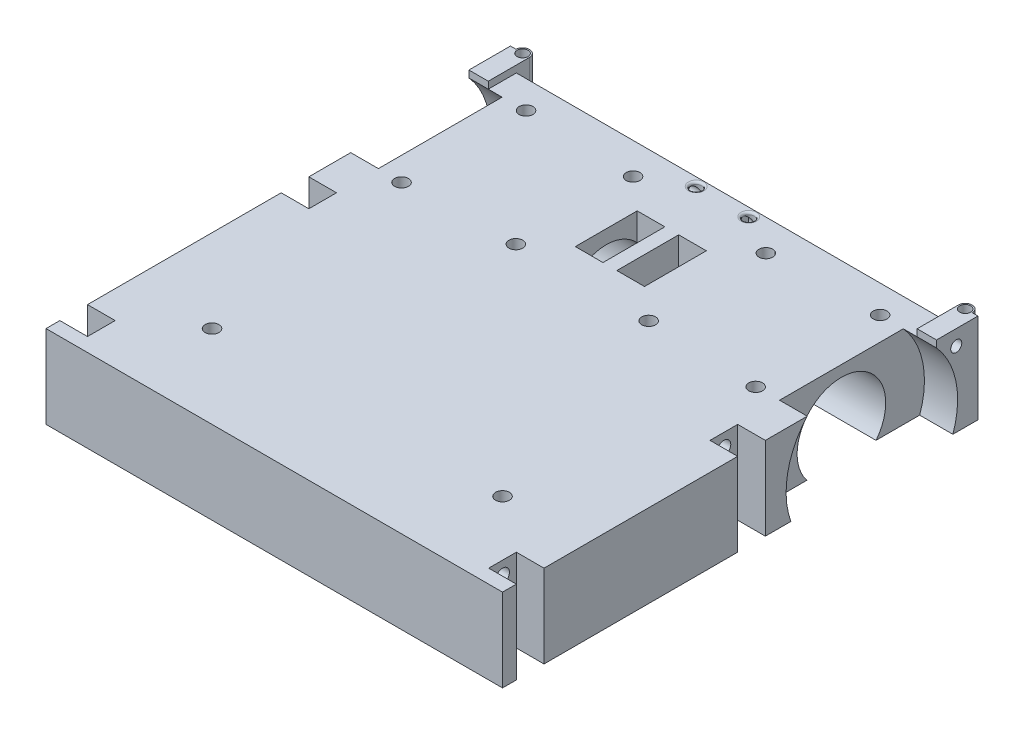
from build123d import *

# Parameters (mm, degrees)
ESQUISSE2_W             = 165
ESQUISSE2_H             = 165
BASE_DEPTH              = 30
ESQUISSE3_R             = 15
BLOC_MOTEUR_1_DEPTH     = 80
ESQUISSE4_W             = 10
ESQUISSE4_H             = 22.360679774
ACCES_MOTEUR_DEPTH      = 37
ESQUISSE6_R             = 16.01
BLOC_MOTEUR_2_DEPTH     = 37
ESQUISSE7_R             = 2.5
VIS_MOTEUR_DEPTH        = 121.467838032
ESQUISSE8_R             = 2.5
VIS_PATIN_DEPTH         = 121.467838032
ESQUISSE12_R            = 30
ESPACE_ROUE_DEPTH       = 10
FIXE_PORTE_1_DEPTH      = 2.5
FIXE_PORTE_1_DEPTH_BACK = 10
ESQUISSE14_R            = 2
ESQUISSE15_W            = 5
ESQUISSE15_H            = 10.139320225
FIXE_PORTE_2_DEPTH      = 2.5
ESQUISSE16_R            = 2
FIXE_PORTE_3_DEPTH      = 10
ESQUISSE18_R            = 2
VIDE_CORDE_COTE_DEPTH   = 75
ESQUISSE19_R            = 2
VIDEO_CORDE_HAUT_DEPTH  = 5
CONGE_CORDE_R           = 0.8
ESQUISSE20_R            = 2
BOSS_MAX_PORTE_DEPTH    = 2
ESQUISSE23_W            = 10
ESQUISSE23_H            = 30
VIDE_TIGE_DEPTH         = 10
VIDE_VIS_REACH          = 185.737
ESQUISSE25_R            = 2.5


with BuildPart() as part:
    # Esquisse2 → BASE (new body)
    with BuildSketch(Plane(origin=(0, 0, 0), x_dir=(1, 0, 0), z_dir=(0, 1, 0))):
        Rectangle(ESQUISSE2_W, ESQUISSE2_H)
    extrude(amount=BASE_DEPTH)

    # Esquisse3 → BLOC MOTEUR 1. (cut)
    with BuildSketch(Plane(origin=(82.5, 0, 0), x_dir=(0, 0, -1), z_dir=(1, 0, 0))):
        with Locations((50, 10)):
            Circle(ESQUISSE3_R)
    bloc_moteur_1 = extrude(amount=-BLOC_MOTEUR_1_DEPTH, mode=Mode.SUBTRACT)

    # Esquisse4 → ACCES MOTEUR (cut)
    with BuildSketch(Plane.XZ):
        with Locations((7.5, -50)):
            Rectangle(ESQUISSE4_W, ESQUISSE4_H)
    acces_moteur = extrude(amount=-ACCES_MOTEUR_DEPTH, mode=Mode.SUBTRACT)

    # Esquisse6 → BLOC MOTEUR 2 (cut)
    with BuildSketch(Plane(origin=(82.5, 0, 0), x_dir=(0, 0, -1), z_dir=(1, 0, 0))):
        with Locations((50, 10)):
            Circle(ESQUISSE6_R)
    bloc_moteur_2 = extrude(amount=-BLOC_MOTEUR_2_DEPTH, mode=Mode.SUBTRACT)

    # SYM BLOC MOTEUR: BLOC MOTEUR 1., ACCES MOTEUR, BLOC MOTEUR 2 across plane
    add(bloc_moteur_1.mirror(Plane(origin=(0, 0, 0), x_dir=(0, 0, 1), z_dir=(1, 0, 0))), mode=Mode.SUBTRACT)
    add(acces_moteur.mirror(Plane(origin=(0, 0, 0), x_dir=(0, 0, 1), z_dir=(1, 0, 0))), mode=Mode.SUBTRACT)
    add(bloc_moteur_2.mirror(Plane(origin=(0, 0, 0), x_dir=(0, 0, 1), z_dir=(1, 0, 0))), mode=Mode.SUBTRACT)

    # Esquisse7 → VIS MOTEUR (cut, through all)
    with BuildSketch(Plane.XZ):
        with Locations(Location((-64, -27.497196314, 0), (0, 0, 270))):
            Circle(ESQUISSE7_R)
        with Locations(Location((-24, -28.819660113, 0), (0, 0, 270))):
            Circle(ESQUISSE7_R)
        with Locations(Location((-24, -71.180339887, 0), (0, 0, 270))):
            Circle(ESQUISSE7_R)
        with Locations(Location((-64, -72.502803686, 0), (0, 0, 270))):
            Circle(ESQUISSE7_R)
    vis_moteur = extrude(amount=-VIS_MOTEUR_DEPTH, mode=Mode.SUBTRACT)

    # SYM VIS: VIS MOTEUR across plane
    add(vis_moteur.mirror(Plane(origin=(0, 0, 0), x_dir=(0, 0, 1), z_dir=(1, 0, 0))), mode=Mode.SUBTRACT)

    # Esquisse8 → VIS PATIN (cut, through all)
    with BuildSketch(Plane.XZ):
        with Locations(Location((-52.5, 52.5, 0), (0, 0, 270))):
            Circle(ESQUISSE8_R)
        with Locations(Location((52.5, 52.5, 0), (0, 0, 270))):
            Circle(ESQUISSE8_R)
    extrude(amount=-VIS_PATIN_DEPTH, mode=Mode.SUBTRACT)

    # Esquisse12 → ESPACE ROUE (cut)
    with BuildSketch(Plane.ZY.offset(82.5)):
        with Locations((-50, 10)):
            Circle(ESQUISSE12_R)
    espace_roue = extrude(amount=-ESPACE_ROUE_DEPTH, mode=Mode.SUBTRACT)

    # SYM ESPACE ROUE: ESPACE ROUE across plane
    add(espace_roue.mirror(Plane(origin=(0, 0, 0), x_dir=(0, 0, 1), z_dir=(1, 0, 0))), mode=Mode.SUBTRACT)

    # Esquisse14 → FIXE PORTE 1 (add, two sides: drawn at the far end of the back side and taken through both)
    # profile 1 of 2: a face of its own
    with BuildSketch(Plane(origin=(0, 30, 0), x_dir=(1, 0, 0), z_dir=(0, 1, 0)).offset(-FIXE_PORTE_1_DEPTH_BACK)):
        with BuildLine():
            ThreePointArc((-77.5, 87.245138583), (-80, 89.745138583), (-82.5, 87.245138583))
            Line((-82.5, 87.245138583), (-82.5, 82.5))
            Line((-82.5, 82.5), (-77.5, 82.5))
            Line((-77.5, 82.5), (-77.5, 87.245138583))
        make_face()
        with Locations(Location((-80, 87.245138583, 0), (0, 0, 270))):
            Circle(ESQUISSE14_R, mode=Mode.SUBTRACT)
    # profile 2 of 2: a face of its own
    with BuildSketch(Plane(origin=(0, 30, 0), x_dir=(1, 0, 0), z_dir=(0, 1, 0)).offset(-FIXE_PORTE_1_DEPTH_BACK)):
        with BuildLine():
            Line((77.5, 87.245138583), (77.5, 82.5))
            Line((77.5, 82.5), (82.5, 82.5))
            Line((82.5, 82.5), (82.5, 87.245138583))
            ThreePointArc((82.5, 87.245138583), (80, 89.745138583), (77.5, 87.245138583))
        make_face()
        with Locations(Location((80, 87.245138583, 0), (0, 0, 270))):
            Circle(ESQUISSE14_R, mode=Mode.SUBTRACT)
    extrude(amount=FIXE_PORTE_1_DEPTH + FIXE_PORTE_1_DEPTH_BACK)

    # Esquisse15 → FIXE PORTE 2 (add)
    with BuildSketch(Plane(origin=(0, 30, 0), x_dir=(1, 0, 0), z_dir=(0, 1, 0))):
        with Locations((-80, 77.430339887)):
            Rectangle(ESQUISSE15_W, ESQUISSE15_H)
        with Locations((80, 77.430339887)):
            Rectangle(ESQUISSE15_W, ESQUISSE15_H)
    extrude(amount=FIXE_PORTE_2_DEPTH)

    # Esquisse16 → FIXE PORTE 3 (add)
    # profile 1 of 2: a face of its own
    with BuildSketch(Plane.XZ):
        with BuildLine():
            Line((-82.5, -82.5), (-82.5, -87.245138583))
            ThreePointArc((-82.5, -87.245138583), (-80, -89.745138583), (-77.5, -87.245138583))
            Line((-77.5, -87.245138583), (-77.5, -82.5))
            Line((-77.5, -82.5), (-82.5, -82.5))
        make_face()
        with Locations(Location((-80, -87.245138583, 0), (0, 0, 90))):
            Circle(ESQUISSE16_R, mode=Mode.SUBTRACT)
    # profile 2 of 2: a face of its own
    with BuildSketch(Plane.XZ):
        with BuildLine():
            Line((82.5, -82.5), (77.5, -82.5))
            Line((77.5, -82.5), (77.5, -87.245138583))
            ThreePointArc((77.5, -87.245138583), (80, -89.745138583), (82.5, -87.245138583))
            Line((82.5, -87.245138583), (82.5, -82.5))
        make_face()
        with Locations(Location((80, -87.245138583, 0), (0, 0, 90))):
            Circle(ESQUISSE16_R, mode=Mode.SUBTRACT)
    extrude(amount=-FIXE_PORTE_3_DEPTH)

    # Esquisse18 → VIDE CORDE COTE (cut)
    with BuildSketch(Plane(origin=(82.5, 0, 0), x_dir=(0, 0, -1), z_dir=(1, 0, 0))):
        with Locations((79.5, 27)):
            Circle(ESQUISSE18_R)
    vide_corde_cote = extrude(amount=-VIDE_CORDE_COTE_DEPTH, mode=Mode.SUBTRACT)

    # Esquisse19 → VIDEO CORDE HAUT (cut)
    with BuildSketch(Plane(origin=(0, 30, 0), x_dir=(1, 0, 0), z_dir=(0, 1, 0))):
        with Locations(Location((9.5, 79.5, 0), (0, 0, 270))):
            Circle(ESQUISSE19_R)
    video_corde_haut = extrude(amount=-VIDEO_CORDE_HAUT_DEPTH, mode=Mode.SUBTRACT)

    # SYM CORDE: VIDE CORDE COTE, VIDEO CORDE HAUT across plane
    add(vide_corde_cote.mirror(Plane(origin=(0, 0, 0), x_dir=(0, 0, 1), z_dir=(1, 0, 0))), mode=Mode.SUBTRACT)
    add(video_corde_haut.mirror(Plane(origin=(0, 0, 0), x_dir=(0, 0, 1), z_dir=(1, 0, 0))), mode=Mode.SUBTRACT)

    # CONGE CORDE
    conge_corde_edges = [part.edges().sort_by_distance(p)[0] for p in [
        (9.5, 30, -81.5),
        (-9.5, 30, -81.5),
    ]]
    fillet(conge_corde_edges, radius=CONGE_CORDE_R)

    # Esquisse20 → BOSS MAX PORTE (add)
    with BuildSketch(Plane(origin=(82.5, 0, 0), x_dir=(0, 0, -1), z_dir=(1, 0, 0))):
        with BuildLine():
            Line((72.360679775, 30), (72.360679775, 32.5))
            Line((72.360679775, 32.5), (87.360679775, 32.5))
            Line((87.360679775, 32.5), (87.360679775, 0))
            Line((87.360679775, 0), (78.284271247, 0))
            ThreePointArc((78.284271247, 0), (79.431747587, 15.811388301), (72.360679775, 30))
        make_face()
        with Locations((79.5, 27)):
            Circle(ESQUISSE20_R, mode=Mode.SUBTRACT)
    boss_max_porte = extrude(amount=BOSS_MAX_PORTE_DEPTH)

    # SYM MAX PORTE: BOSS MAX PORTE across plane
    add(boss_max_porte.mirror(Plane(origin=(0, 0, 0), x_dir=(0, 0, 1), z_dir=(1, 0, 0))))

    # Esquisse23 → VIDE TIGE (cut)
    with BuildSketch(Plane(origin=(82.5, 0, 0), x_dir=(0, 0, -1), z_dir=(1, 0, 0))):
        with Locations((-72.5, 15)):
            Rectangle(ESQUISSE23_W, ESQUISSE23_H)
        with Locations((7.5, 15)):
            Rectangle(ESQUISSE23_W, ESQUISSE23_H)
    vide_tige = extrude(amount=-VIDE_TIGE_DEPTH, mode=Mode.SUBTRACT)

    # SYM TIGE: VIDE TIGE across plane
    add(vide_tige.mirror(Plane(origin=(0, 0, 0), x_dir=(0, 0, 1), z_dir=(1, 0, 0))), mode=Mode.SUBTRACT)

    # Esquisse25 → VIDE VIS (cut, up to next)
    with BuildSketch(Plane(origin=(72.5, 0, 0), x_dir=(0, 0, -1), z_dir=(1, 0, 0)), mode=Mode.PRIVATE) as vide_vis_sk1:
        with Locations((-72.5, 25)):
            Circle(ESQUISSE25_R)
    vide_vis_tool1 = extrude(vide_vis_sk1.sketch, amount=-VIDE_VIS_REACH, mode=Mode.PRIVATE) & part.part
    # Esquisse25 → VIDE VIS (cut, up to next)
    with BuildSketch(Plane(origin=(72.5, 0, 0), x_dir=(0, 0, -1), z_dir=(1, 0, 0)), mode=Mode.PRIVATE) as vide_vis_sk2:
        with Locations((-72.5, 15)):
            Circle(ESQUISSE25_R)
    vide_vis_tool2 = extrude(vide_vis_sk2.sketch, amount=-VIDE_VIS_REACH, mode=Mode.PRIVATE) & part.part
    # Esquisse25 → VIDE VIS (cut, up to next)
    with BuildSketch(Plane(origin=(72.5, 0, 0), x_dir=(0, 0, -1), z_dir=(1, 0, 0)), mode=Mode.PRIVATE) as vide_vis_sk3:
        with Locations((-72.5, 5)):
            Circle(ESQUISSE25_R)
    vide_vis_tool3 = extrude(vide_vis_sk3.sketch, amount=-VIDE_VIS_REACH, mode=Mode.PRIVATE) & part.part
    # Esquisse25 → VIDE VIS (cut, up to next)
    with BuildSketch(Plane(origin=(72.5, 0, 0), x_dir=(0, 0, -1), z_dir=(1, 0, 0)), mode=Mode.PRIVATE) as vide_vis_sk4:
        with Locations(Location((7.5, 5, 0), (0, 0, 180))):
            Circle(ESQUISSE25_R)
    vide_vis_tool4 = extrude(vide_vis_sk4.sketch, amount=-VIDE_VIS_REACH, mode=Mode.PRIVATE) & part.part
    # Esquisse25 → VIDE VIS (cut, up to next)
    with BuildSketch(Plane(origin=(72.5, 0, 0), x_dir=(0, 0, -1), z_dir=(1, 0, 0)), mode=Mode.PRIVATE) as vide_vis_sk5:
        with Locations(Location((7.5, 25, 0), (0, 0, 180))):
            Circle(ESQUISSE25_R)
    vide_vis_tool5 = extrude(vide_vis_sk5.sketch, amount=-VIDE_VIS_REACH, mode=Mode.PRIVATE) & part.part
    # Esquisse25 → VIDE VIS (cut, up to next)
    with BuildSketch(Plane(origin=(72.5, 0, 0), x_dir=(0, 0, -1), z_dir=(1, 0, 0)), mode=Mode.PRIVATE) as vide_vis_sk6:
        with Locations(Location((7.5, 15, 0), (0, 0, 180))):
            Circle(ESQUISSE25_R)
    vide_vis_tool6 = extrude(vide_vis_sk6.sketch, amount=-VIDE_VIS_REACH, mode=Mode.PRIVATE) & part.part
    add(vide_vis_tool1.solids().sort_by_distance((72.5, 25, 72.5))[0], mode=Mode.SUBTRACT)
    add(vide_vis_tool2.solids().sort_by_distance((72.5, 15, 72.5))[0], mode=Mode.SUBTRACT)
    add(vide_vis_tool3.solids().sort_by_distance((72.5, 5, 72.5))[0], mode=Mode.SUBTRACT)
    add(vide_vis_tool4.solids().sort_by_distance((72.5, 5, -7.5))[0], mode=Mode.SUBTRACT)
    add(vide_vis_tool5.solids().sort_by_distance((72.5, 25, -7.5))[0], mode=Mode.SUBTRACT)
    add(vide_vis_tool6.solids().sort_by_distance((72.5, 15, -7.5))[0], mode=Mode.SUBTRACT)


solid = part.part
